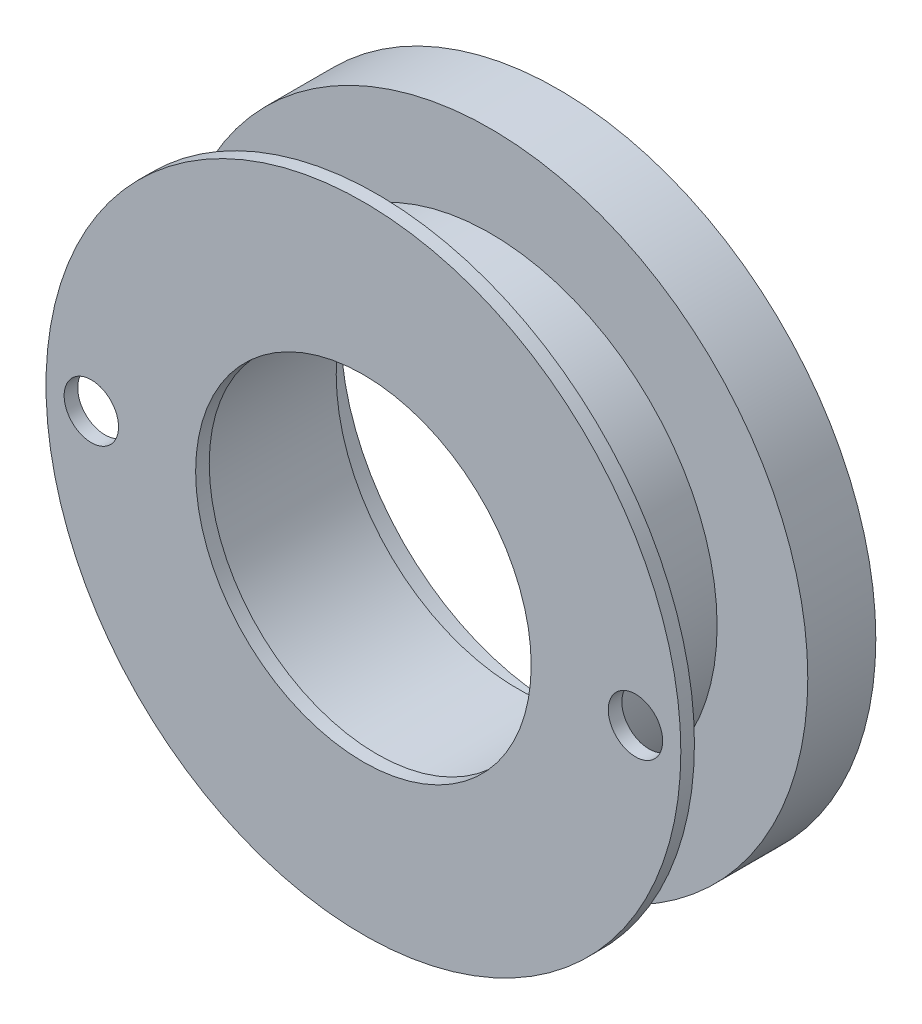
from build123d import *

# Parameters (mm, degrees)
D10_PILOT_AND_M10X0P5_THREAD_ENVELOPE_START = -1
SKETCH1_R                                   = 5
SKETCH1_R_2                                 = 4
D10_PILOT_AND_M10X0P5_THREAD_ENVELOPE_DEPTH = 2.5
OUTER_RACE_INNER_SHOULDER_ID7P4_START       = 1.5
SKETCH2_R                                   = 5
SKETCH2_R_2                                 = 3.7
OUTER_RACE_INNER_SHOULDER_ID7P4_DEPTH       = 0.3
INBOARD_G10_RETENTION_FLANGE_H0P3_START     = 1.5
SKETCH3_R                                   = 7
SKETCH3_R_2                                 = 3.7
INBOARD_G10_RETENTION_FLANGE_H0P3_DEPTH     = 0.3
M14X0P5_BEARING_CAP_BOSS_START              = -1.6
SKETCH4_R                                   = 7
SKETCH4_R_2                                 = 4
M14X0P5_BEARING_CAP_BOSS_DEPTH              = 0.6
FLANGED_RACE_POCKET_D9P6_START              = -2.5
SKETCH5_R                                   = 7
SKETCH5_R_2                                 = 4.8
FLANGED_RACE_POCKET_D9P6_DEPTH              = 0.9
SKETCH6_R                                   = 0.6
TWO_PIN_WRENCH_HOLES_D1P2_DEPTH             = 0.301


with BuildPart() as part:
    # Sketch1 → D10_Pilot_And_M10x0p5_Thread_Envelope (new body)
    with BuildSketch(Plane.XY.offset(D10_PILOT_AND_M10X0P5_THREAD_ENVELOPE_START)):
        Circle(SKETCH1_R)
        Circle(SKETCH1_R_2, mode=Mode.SUBTRACT)
    extrude(amount=D10_PILOT_AND_M10X0P5_THREAD_ENVELOPE_DEPTH)

    # Sketch2 → Outer_Race_Inner_Shoulder_ID7p4 (add)
    with BuildSketch(Plane.XY.offset(OUTER_RACE_INNER_SHOULDER_ID7P4_START)):
        Circle(SKETCH2_R)
        Circle(SKETCH2_R_2, mode=Mode.SUBTRACT)
    extrude(amount=OUTER_RACE_INNER_SHOULDER_ID7P4_DEPTH)

    # Sketch3 → Inboard_G10_Retention_Flange_H0p3 (add)
    with BuildSketch(Plane.XY.offset(INBOARD_G10_RETENTION_FLANGE_H0P3_START)):
        Circle(SKETCH3_R)
        Circle(SKETCH3_R_2, mode=Mode.SUBTRACT)
    extrude(amount=INBOARD_G10_RETENTION_FLANGE_H0P3_DEPTH)

    # Sketch4 → M14x0p5_Bearing_Cap_Boss (add)
    with BuildSketch(Plane.XY.offset(M14X0P5_BEARING_CAP_BOSS_START)):
        Circle(SKETCH4_R)
        Circle(SKETCH4_R_2, mode=Mode.SUBTRACT)
    extrude(amount=M14X0P5_BEARING_CAP_BOSS_DEPTH)

    # Sketch5 → Flanged_Race_Pocket_D9p6 (add)
    with BuildSketch(Plane.XY.offset(FLANGED_RACE_POCKET_D9P6_START)):
        Circle(SKETCH5_R)
        Circle(SKETCH5_R_2, mode=Mode.SUBTRACT)
    extrude(amount=FLANGED_RACE_POCKET_D9P6_DEPTH)

    # Sketch6 → Two_Pin_Wrench_Holes_D1p2 (cut)
    with BuildSketch(Plane.XY.offset(1.8)):
        with Locations((-6, 0)):
            Circle(SKETCH6_R)
        with Locations((6, 0)):
            Circle(SKETCH6_R)
    extrude(amount=-TWO_PIN_WRENCH_HOLES_D1P2_DEPTH, mode=Mode.SUBTRACT)


solid = part.part
